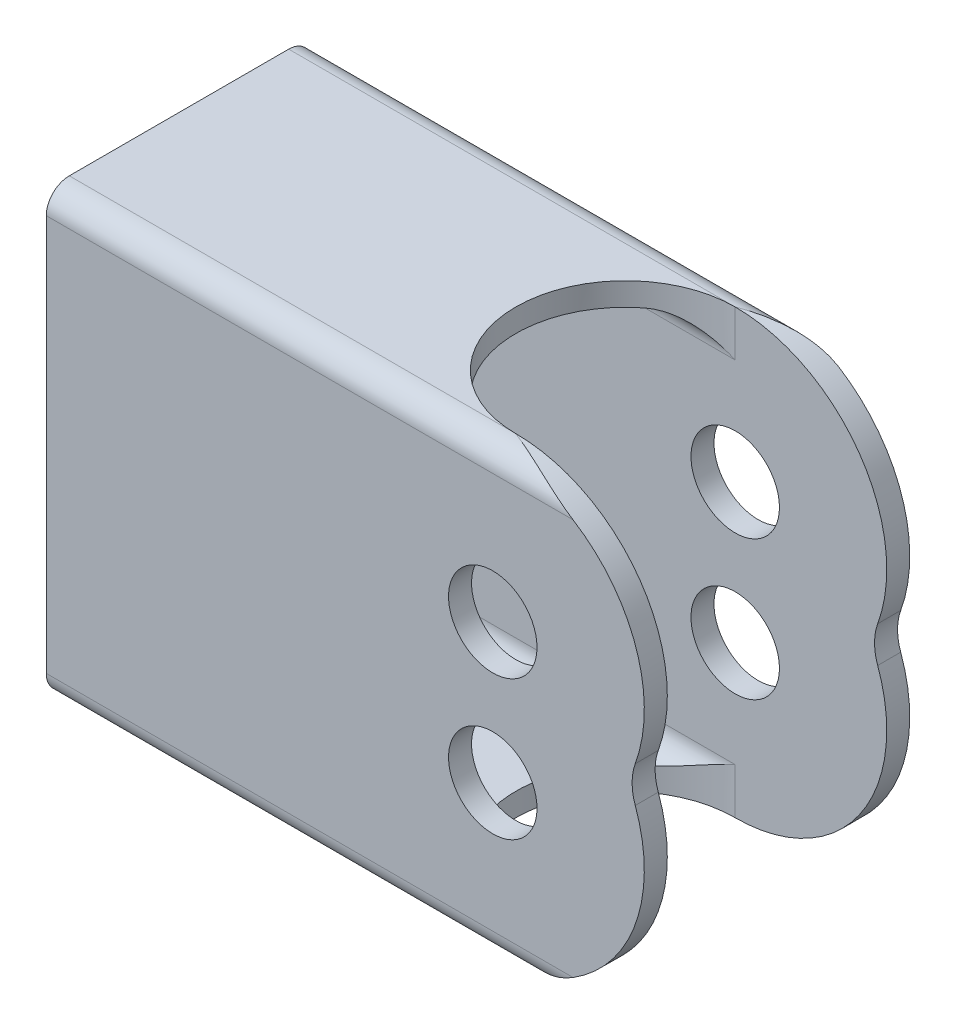
from build123d import *

# Parameters (mm, degrees)
SQUARE_TUBE_1_5X0_75_0_065_4130_TUBE_1_DEPTH = 43.474215441
SKETCH3_R                                    = 3.175
CUT_EXTRUDE1_DEPTH                           = 51.049231095
CUT_EXTRUDE2_DEPTH                           = 55.229578607
FILLET1_R                                    = 3.81


with BuildPart() as part:
    # Sketch2 → Square tube 1.5X0.75-0.065 4130 TUBE(1) (new body)
    with BuildSketch(Plane.YZ):
        with BuildLine():
            Line((-14.224, -9.525), (14.224, -9.525))
            ThreePointArc((14.224, -9.525), (15.391433296, -9.041433296), (15.875, -7.874))
            Line((15.875, -7.874), (15.875, 7.874))
            ThreePointArc((15.875, 7.874), (15.391433296, 9.041433296), (14.224, 9.525))
            Line((14.224, 9.525), (-14.224, 9.525))
            ThreePointArc((-14.224, 9.525), (-15.391433296, 9.041433296), (-15.875, 7.874))
            Line((-15.875, 7.874), (-15.875, -7.874))
            ThreePointArc((-15.875, -7.874), (-15.391433296, -9.041433296), (-14.224, -9.525))
        make_face()
        with BuildLine():
            Line((-12.573, 7.874), (12.573, 7.874))
            ThreePointArc((12.573, 7.874), (13.740433296, 7.390433296), (14.224, 6.223))
            Line((14.224, 6.223), (14.224, -6.223))
            ThreePointArc((14.224, -6.223), (13.740433296, -7.390433296), (12.573, -7.874))
            Line((12.573, -7.874), (-12.573, -7.874))
            ThreePointArc((-12.573, -7.874), (-13.740433296, -7.390433296), (-14.224, -6.223))
            Line((-14.224, -6.223), (-14.224, 6.223))
            ThreePointArc((-14.224, 6.223), (-13.740433296, 7.390433296), (-12.573, 7.874))
        make_face(mode=Mode.SUBTRACT)
    extrude(amount=SQUARE_TUBE_1_5X0_75_0_065_4130_TUBE_1_DEPTH)

    # Sketch3 → Cut-Extrude1 (cut, through all)
    with BuildSketch(Plane.XY.offset(9.525)):
        with Locations((32.044215441, 5)):
            Circle(SKETCH3_R)
        with Locations((32.044215441, -5)):
            Circle(SKETCH3_R)
        with BuildLine():
            Line((43.474215441, -15.875), (32.044215441, -15.875))
            ThreePointArc((32.044215441, -15.875), (41.335087978, -10.652018445), (41.701628397, 0))
            ThreePointArc((41.701628397, 0), (41.335087978, 10.652018445), (32.044215441, 15.875))
            Line((32.044215441, 15.875), (43.474215441, 15.875))
            Line((43.474215441, 15.875), (43.474215441, -15.875))
        make_face()
    extrude(amount=-CUT_EXTRUDE1_DEPTH, mode=Mode.SUBTRACT)

    # Sketch4 → Cut-Extrude2 (cut, through all)
    with BuildSketch(Plane(origin=(0, 15.875, 0), x_dir=(1, 0, 0), z_dir=(0, 1, 0))):
        with BuildLine():
            Line((39.849040615, -7.874), (32.044215441, -7.874))
            ThreePointArc((32.044215441, -7.874), (24.170215441, 0), (32.044215441, 7.874))
            Line((32.044215441, 7.874), (39.849040615, 7.874))
            Line((39.849040615, 7.874), (39.849040615, -7.874))
        make_face()
    extrude(amount=-CUT_EXTRUDE2_DEPTH, mode=Mode.SUBTRACT)

    # Fillet1
    fillet1_edges = [part.edges().sort_by_distance(p)[0] for p in [
        (41.701628397, 0, -8.6995),
        (41.701628397, 0, 8.6995),
    ]]
    fillet(fillet1_edges, radius=FILLET1_R)


solid = part.part
